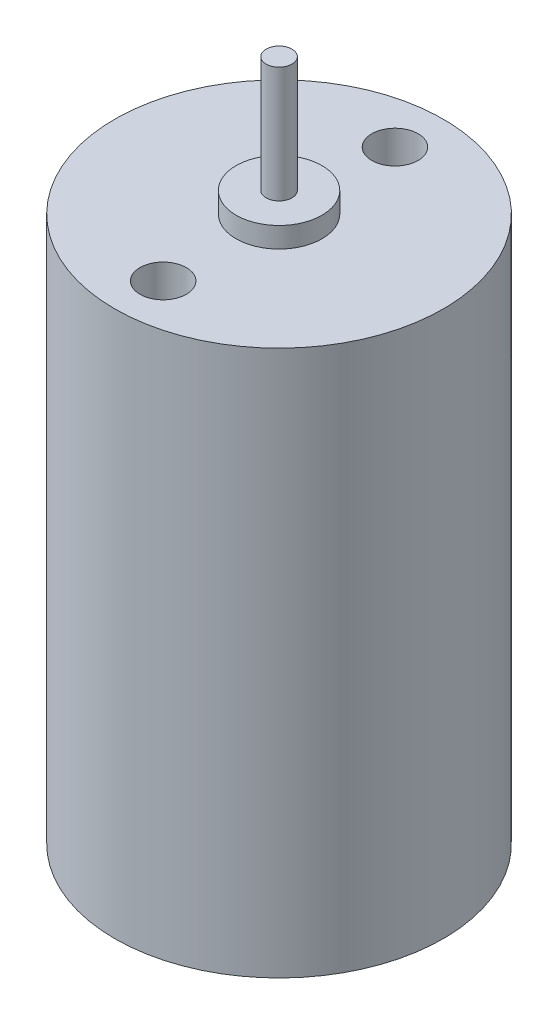
from build123d import *

# Parameters (mm, degrees)
SKETCH1_R           = 12.05
BOSS_EXTRUDE1_DEPTH = 40
SKETCH2_R           = 3.15
BOSS_EXTRUDE2_DEPTH = 1.5
SKETCH3_R           = 0.95
BOSS_EXTRUDE3_DEPTH = 8.5
SKETCH4_R           = 1.7
CUT_EXTRUDE1_DEPTH  = 5


with BuildPart() as part:
    # Sketch1 → Boss-Extrude1 (new body)
    with BuildSketch(Plane(origin=(0, 0, 0), x_dir=(1, 0, 0), z_dir=(0, 1, 0))):
        with Locations(Location((0, 0, 0), (0, 0, 270))):
            Circle(SKETCH1_R)
    extrude(amount=BOSS_EXTRUDE1_DEPTH)

    # Sketch2 → Boss-Extrude2 (add)
    with BuildSketch(Plane(origin=(0, 40, 0), x_dir=(1, 0, 0), z_dir=(0, 1, 0))):
        with Locations(Location((0, 0, 0), (0, 0, 270))):
            Circle(SKETCH2_R)
    extrude(amount=BOSS_EXTRUDE2_DEPTH)

    # Sketch3 → Boss-Extrude3 (add)
    with BuildSketch(Plane(origin=(0, 41.5, 0), x_dir=(1, 0, 0), z_dir=(0, 1, 0))):
        with Locations(Location((0, 0, 0), (0, 0, 270))):
            Circle(SKETCH3_R)
    extrude(amount=BOSS_EXTRUDE3_DEPTH)

    # Sketch4 → Cut-Extrude1 (cut)
    with BuildSketch(Plane(origin=(0, 40, 0), x_dir=(1, 0, 0), z_dir=(0, 1, 0))):
        with Locations(Location((0, 8.5, 0), (0, 0, 270))):
            Circle(SKETCH4_R)
        with Locations(Location((0, -8.5, 0), (0, 0, 270))):
            Circle(SKETCH4_R)
    extrude(amount=-CUT_EXTRUDE1_DEPTH, mode=Mode.SUBTRACT)


solid = part.part
